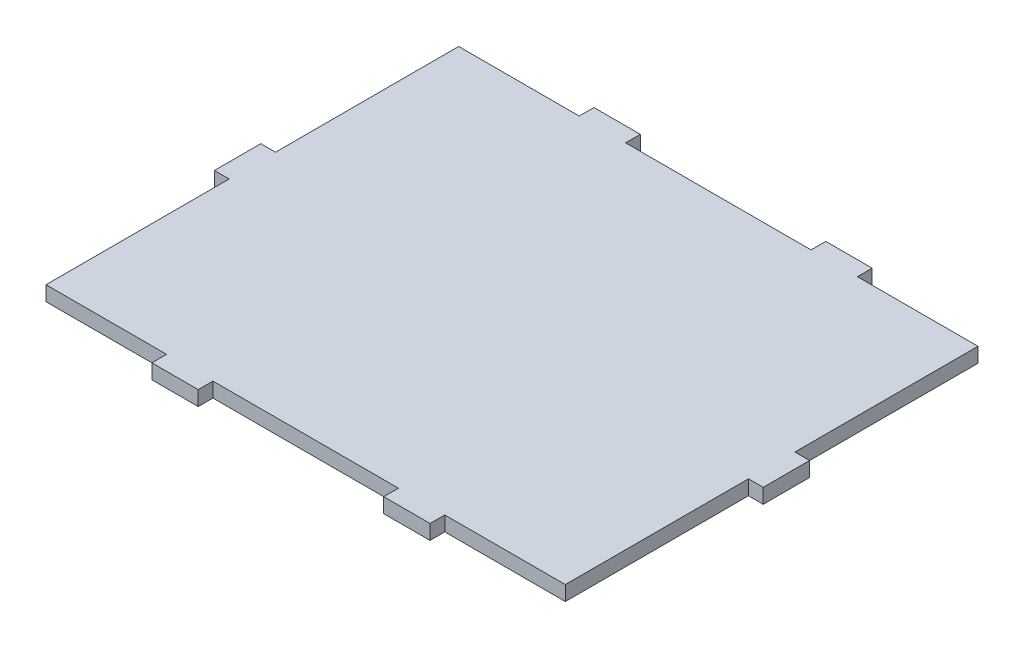
from build123d import *

# Parameters (mm, degrees)
SKETCH1_W           = 112
SKETCH1_H           = 95.35
BOSS_EXTRUDE1_DEPTH = 3.175
SKETCH2_W           = 40
SKETCH2_H           = 3.175
SKETCH2_W_2         = 26
CUT_EXTRUDE1_DEPTH  = 74.613763998
SKETCH4_W           = 10
SKETCH4_H           = 3.175
BOSS_EXTRUDE2_DEPTH = 3.175
SKETCH5_W           = 10
SKETCH5_H           = 3.175
BOSS_EXTRUDE3_DEPTH = 3.175


with BuildPart() as part:
    # Sketch1 → Boss-Extrude1 (new body)
    with BuildSketch(Plane(origin=(0, 0, 0), x_dir=(1, 0, 0), z_dir=(0, 1, 0))):
        Rectangle(SKETCH1_W, SKETCH1_H)
    extrude(amount=BOSS_EXTRUDE1_DEPTH)

    # Sketch2 → Cut-Extrude1 (cut, through all)
    with BuildSketch(Plane(origin=(0, 3.175, 0), x_dir=(1, 0, 0), z_dir=(0, 1, 0))):
        with Locations((0, 46.0875)):
            Rectangle(SKETCH2_W, SKETCH2_H)
        with Locations((43, 46.0875)):
            Rectangle(SKETCH2_W_2, SKETCH2_H)
        with Locations((-43, 46.0875)):
            Rectangle(SKETCH2_W_2, SKETCH2_H)
        with Locations((0, -46.0875)):
            Rectangle(SKETCH2_W, SKETCH2_H)
        with Locations((-43, -46.0875)):
            Rectangle(SKETCH2_W_2, SKETCH2_H)
        with Locations((43, -46.0875)):
            Rectangle(SKETCH2_W_2, SKETCH2_H)
    extrude(amount=-CUT_EXTRUDE1_DEPTH, mode=Mode.SUBTRACT)

    # Sketch4 → Boss-Extrude2 (add)
    with BuildSketch(Plane.ZY.offset(56)):
        with Locations((0, 1.5875)):
            Rectangle(SKETCH4_W, SKETCH4_H)
    extrude(amount=BOSS_EXTRUDE2_DEPTH)

    # Sketch5 → Boss-Extrude3 (add)
    with BuildSketch(Plane(origin=(56, 0, 0), x_dir=(0, 0, -1), z_dir=(1, 0, 0))):
        with Locations((0, 1.5875)):
            Rectangle(SKETCH5_W, SKETCH5_H)
    extrude(amount=BOSS_EXTRUDE3_DEPTH)


solid = part.part
